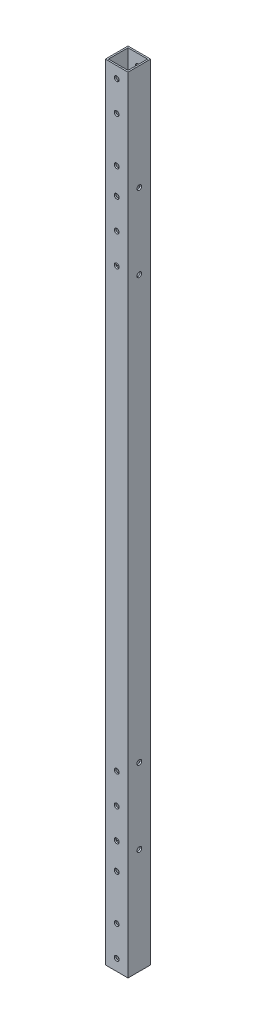
from build123d import *

# Parameters (mm, degrees)
SKETCH_1_W          = 15
SKETCH_1_H          = 15
SKETCH_1_W_2        = 13
SKETCH_1_H_2        = 13
EXTRUDE_1_DEPTH     = 520
SKETCH_2_R          = 1.6
CUT_EXTRUDE_1_DEPTH = 521.270362408
SKETCH_3_R          = 1.6
CUT_EXTRUDE_2_DEPTH = 521.270362408


with BuildPart() as part:
    # 草图1 → 拉伸-薄壁1 (new body)
    with BuildSketch(Plane(origin=(0, 0, 0), x_dir=(1, 0, 0), z_dir=(0, 1, 0))):
        Rectangle(SKETCH_1_W, SKETCH_1_H)
        Rectangle(SKETCH_1_W_2, SKETCH_1_H_2, mode=Mode.SUBTRACT)
    extrude(amount=EXTRUDE_1_DEPTH)

    # 草图2 → 切除-拉伸1 (cut, through all)
    with BuildSketch(Plane.XY.offset(7.5)):
        with Locations((0, 7.5)):
            Circle(SKETCH_2_R)
        with Locations((0, 27.5)):
            Circle(SKETCH_2_R)
        with Locations((0, 57.5)):
            Circle(SKETCH_2_R)
        with Locations((0, 75)):
            Circle(SKETCH_2_R)
        with Locations((0, 95)):
            Circle(SKETCH_2_R)
        with Locations((0, 115)):
            Circle(SKETCH_2_R)
        with Locations(Location((0, 405, 0), (0, 0, 180))):
            Circle(SKETCH_2_R)
        with Locations(Location((0, 425, 0), (0, 0, 180))):
            Circle(SKETCH_2_R)
        with Locations(Location((0, 445, 0), (0, 0, 180))):
            Circle(SKETCH_2_R)
        with Locations(Location((0, 462.5, 0), (0, 0, 180))):
            Circle(SKETCH_2_R)
        with Locations(Location((0, 492.5, 0), (0, 0, 180))):
            Circle(SKETCH_2_R)
        with Locations(Location((0, 512.5, 0), (0, 0, 180))):
            Circle(SKETCH_2_R)
    extrude(amount=-CUT_EXTRUDE_1_DEPTH, mode=Mode.SUBTRACT)

    # 草图3 → 切除-拉伸2 (cut, through all)
    with BuildSketch(Plane(origin=(7.5, 0, 0), x_dir=(0, 0, -1), z_dir=(1, 0, 0))):
        with Locations((0, 70)):
            Circle(SKETCH_3_R)
        with Locations((0, 120)):
            Circle(SKETCH_3_R)
        with Locations((0, 400)):
            Circle(SKETCH_3_R)
        with Locations((0, 450)):
            Circle(SKETCH_3_R)
    extrude(amount=-CUT_EXTRUDE_2_DEPTH, mode=Mode.SUBTRACT)


solid = part.part
